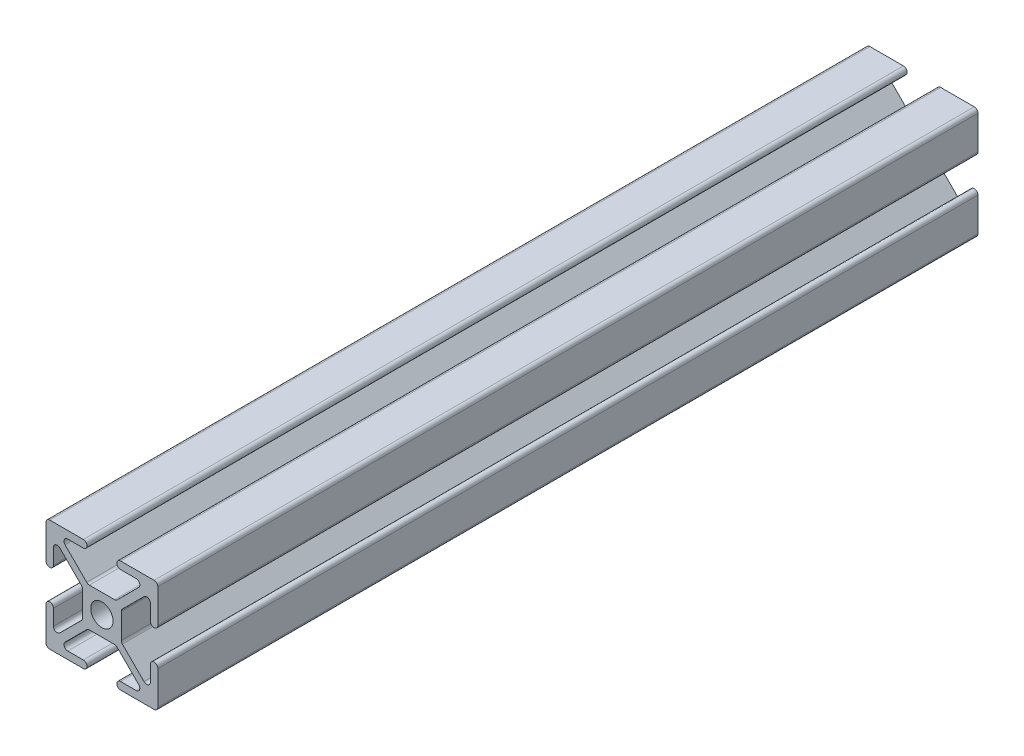
from build123d import *

# Parameters (mm, degrees)
SALIENTE_EXTRUIR1_DEPTH = 220
CROQUIS2_R              = 3
CORTAR_EXTRUIR1_DEPTH   = 222.020361053
CORTAR_EXTRUIR3_DEPTH   = 222.020361053


with BuildPart() as part:
    # Croquis1 → Saliente-Extruir1 (new body)
    with BuildSketch(Plane.XY):
        with BuildLine():
            Line((-14, 15), (14, 15))
            ThreePointArc((14, 15), (14.707106781, 14.707106781), (15, 14))
            Line((15, 14), (15, -14))
            ThreePointArc((15, -14), (14.707106781, -14.707106781), (14, -15))
            Line((14, -15), (-14, -15))
            ThreePointArc((-14, -15), (-14.707106781, -14.707106781), (-15, -14))
            Line((-15, -14), (-15, 14))
            ThreePointArc((-15, 14), (-14.707106781, 14.707106781), (-14, 15))
        make_face()
    extrude(amount=-SALIENTE_EXTRUIR1_DEPTH)

    # Croquis2 → Cortar-Extruir1 (cut, through all)
    with BuildSketch(Plane.XY):
        Circle(CROQUIS2_R)
    extrude(amount=-CORTAR_EXTRUIR1_DEPTH, mode=Mode.SUBTRACT)

    # Croquis3 → Cortar-Extruir3 (cut, through all)
    with BuildSketch(Plane.XY):
        with BuildLine():
            Line((-5.492893219, 4.078679656), (-11.292893219, 9.878679656))
            ThreePointArc((-11.292893219, 9.878679656), (-12.382683432, 10.095452408), (-13, 9.171572875))
            Line((-13, 9.171572875), (-13, 5))
            ThreePointArc((-13, 5), (-14, 4), (-15, 5))
            Line((-15, 5), (-15, -5))
            ThreePointArc((-15, -5), (-14, -4), (-13, -5))
            Line((-13, -5), (-13, -9.171572875))
            ThreePointArc((-13, -9.171572875), (-12.382683432, -10.095452408), (-11.292893219, -9.878679656))
            Line((-11.292893219, -9.878679656), (-5.492893219, -4.078679656))
            ThreePointArc((-5.492893219, -4.078679656), (-5.276120467, -3.754256308), (-5.2, -3.371572875))
            Line((-5.2, -3.371572875), (-5.2, 3.371572875))
            ThreePointArc((-5.2, 3.371572875), (-5.276120467, 3.754256308), (-5.492893219, 4.078679656))
        make_face()
        with BuildLine():
            ThreePointArc((-9.171572875, 13), (-10.095452408, 12.382683432), (-9.878679656, 11.292893219))
            Line((-9.878679656, 11.292893219), (-4.078679656, 5.492893219))
            ThreePointArc((-4.078679656, 5.492893219), (-3.754256308, 5.276120467), (-3.371572875, 5.2))
            Line((-3.371572875, 5.2), (3.371572875, 5.2))
            ThreePointArc((3.371572875, 5.2), (3.754256308, 5.276120467), (4.078679656, 5.492893219))
            Line((4.078679656, 5.492893219), (9.878679656, 11.292893219))
            ThreePointArc((9.878679656, 11.292893219), (10.095452408, 12.382683432), (9.171572875, 13))
            Line((9.171572875, 13), (5, 13))
            ThreePointArc((5, 13), (4, 14), (5, 15))
            Line((5, 15), (-5, 15))
            ThreePointArc((-5, 15), (-4.292893219, 14.707106781), (-4, 14))
            ThreePointArc((-4, 14), (-4.292893219, 13.292893219), (-5, 13))
            Line((-5, 13), (-9.171572875, 13))
        make_face()
        with BuildLine():
            Line((9.878679656, -11.292893219), (4.078679656, -5.492893219))
            ThreePointArc((4.078679656, -5.492893219), (3.754256308, -5.276120467), (3.371572875, -5.2))
            Line((3.371572875, -5.2), (-3.371572875, -5.2))
            ThreePointArc((-3.371572875, -5.2), (-3.754256308, -5.276120467), (-4.078679656, -5.492893219))
            Line((-4.078679656, -5.492893219), (-9.878679656, -11.292893219))
            ThreePointArc((-9.878679656, -11.292893219), (-10.095452408, -12.382683432), (-9.171572875, -13))
            Line((-9.171572875, -13), (-5, -13))
            ThreePointArc((-5, -13), (-4.292893219, -13.292893219), (-4, -14))
            ThreePointArc((-4, -14), (-4.292893219, -14.707106781), (-5, -15))
            Line((-5, -15), (5, -15))
            ThreePointArc((5, -15), (4, -14), (5, -13))
            Line((5, -13), (9.171572875, -13))
            ThreePointArc((9.171572875, -13), (10.095452408, -12.382683432), (9.878679656, -11.292893219))
        make_face()
        with BuildLine():
            ThreePointArc((13, 9.171572875), (12.382683432, 10.095452408), (11.292893219, 9.878679656))
            Line((11.292893219, 9.878679656), (5.492893219, 4.078679656))
            ThreePointArc((5.492893219, 4.078679656), (5.276120467, 3.754256308), (5.2, 3.371572875))
            Line((5.2, 3.371572875), (5.2, -3.371572875))
            ThreePointArc((5.2, -3.371572875), (5.276120467, -3.754256308), (5.492893219, -4.078679656))
            Line((5.492893219, -4.078679656), (11.292893219, -9.878679656))
            ThreePointArc((11.292893219, -9.878679656), (12.382683432, -10.095452408), (13, -9.171572875))
            Line((13, -9.171572875), (13, -5))
            ThreePointArc((13, -5), (14, -4), (15, -5))
            Line((15, -5), (15, 5))
            ThreePointArc((15, 5), (14, 4), (13, 5))
            Line((13, 5), (13, 9.171572875))
        make_face()
    extrude(amount=-CORTAR_EXTRUIR3_DEPTH, mode=Mode.SUBTRACT)


solid = part.part
